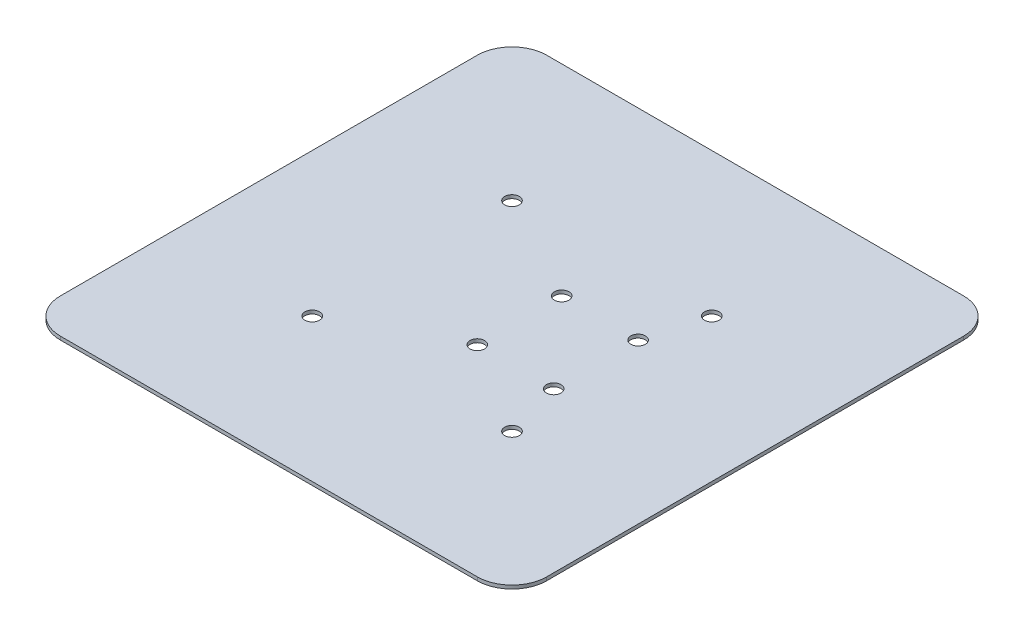
from build123d import *

# Parameters (mm, degrees)
SKETCH1_W           = 140
SKETCH1_H           = 140
BOSS_EXTRUDE1_DEPTH = 1
FILLET1_R           = 10
SKETCH2_R           = 2.1
CUT_EXTRUDE1_DEPTH  = 10


with BuildPart() as part:
    # Sketch1 → Boss-Extrude1 (new body)
    with BuildSketch(Plane(origin=(0, 0, 0), x_dir=(1, 0, 0), z_dir=(0, 1, 0))):
        with Locations((70, -70)):
            Rectangle(SKETCH1_W, SKETCH1_H)
    extrude(amount=BOSS_EXTRUDE1_DEPTH)

    # Fillet1
    fillet1_edges = [part.edges().sort_by_distance(p)[0] for p in [
        (0, 0.5, 0),
        (140, 0.5, 0),
        (140, 0.5, 140),
        (0, 0.5, 140),
    ]]
    fillet(fillet1_edges, radius=FILLET1_R)

    # Sketch2 → Cut-Extrude1 (cut)
    with BuildSketch(Plane(origin=(0, 1, 0), x_dir=(1, 0, 0), z_dir=(0, 1, 0))):
        with Locations(Location((98.75, -98.75, 0), (0, 0, 270))):
            Circle(SKETCH2_R)
        with Locations(Location((41.25, -98.75, 0), (0, 0, 270))):
            Circle(SKETCH2_R)
        with Locations(Location((41.25, -41.25, 0), (0, 0, 270))):
            Circle(SKETCH2_R)
        with Locations(Location((98.75, -41.25, 0), (0, 0, 270))):
            Circle(SKETCH2_R)
        with Locations(Location((72.15, -57.85, 0), (0, 0, 270))):
            Circle(SKETCH2_R)
        with Locations(Location((94.15, -57.85, 0), (0, 0, 270))):
            Circle(SKETCH2_R)
        with Locations(Location((72.15, -82.15, 0), (0, 0, 270))):
            Circle(SKETCH2_R)
        with Locations(Location((94.15, -82.15, 0), (0, 0, 270))):
            Circle(SKETCH2_R)
    extrude(amount=-CUT_EXTRUDE1_DEPTH, mode=Mode.SUBTRACT)


solid = part.part
